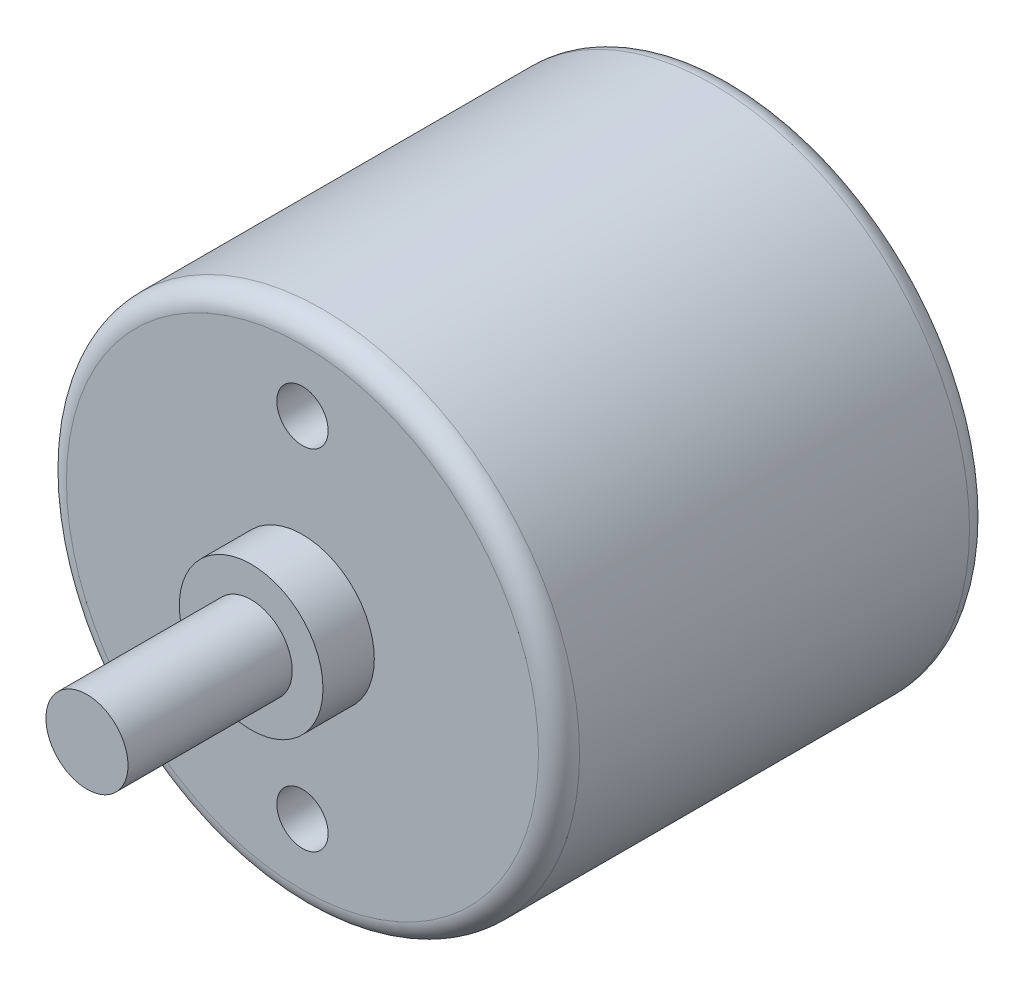
from build123d import *

# Parameters (mm, degrees)
ESBO_O1_R                = 12.5
RESSALTO_EXTRUS_O1_DEPTH = 21
ESBO_O2_R                = 3.5
RESSALTO_EXTRUS_O2_DEPTH = 2.5
FILETE1_R                = 1
ESBO_O3_R                = 2
RESSALTO_EXTRUS_O3_DEPTH = 8
ESBO_O4_R                = 1.25
CORTE_EXTRUS_O1_DEPTH    = 10


with BuildPart() as part:
    # Esboço1 → Ressalto-extrusão1 (new body)
    with BuildSketch(Plane.XY):
        with Locations(Location((0, 0, 0), (0, 0, 180))):
            Circle(ESBO_O1_R)
    extrude(amount=RESSALTO_EXTRUS_O1_DEPTH)

    # Esboço2 → Ressalto-extrusão2 (add)
    with BuildSketch(Plane.XY.offset(21)):
        Circle(ESBO_O2_R)
    extrude(amount=RESSALTO_EXTRUS_O2_DEPTH)

    # Filete1
    filete1_edges = [part.edges().sort_by_distance(p)[0] for p in [
        (12.5, 0, 0),
        (12.5, 0, 21),
    ]]
    fillet(filete1_edges, radius=FILETE1_R)

    # Esboço3 → Ressalto-extrusão3 (add)
    with BuildSketch(Plane.XY.offset(23.5)):
        Circle(ESBO_O3_R)
    extrude(amount=RESSALTO_EXTRUS_O3_DEPTH)

    # Esboço4 → Corte-extrusão1 (cut)
    with BuildSketch(Plane.XY.offset(21)):
        with Locations((0, 8.5)):
            Circle(ESBO_O4_R)
        with Locations((0, -8.5)):
            Circle(ESBO_O4_R)
    extrude(amount=-CORTE_EXTRUS_O1_DEPTH, mode=Mode.SUBTRACT)


solid = part.part
